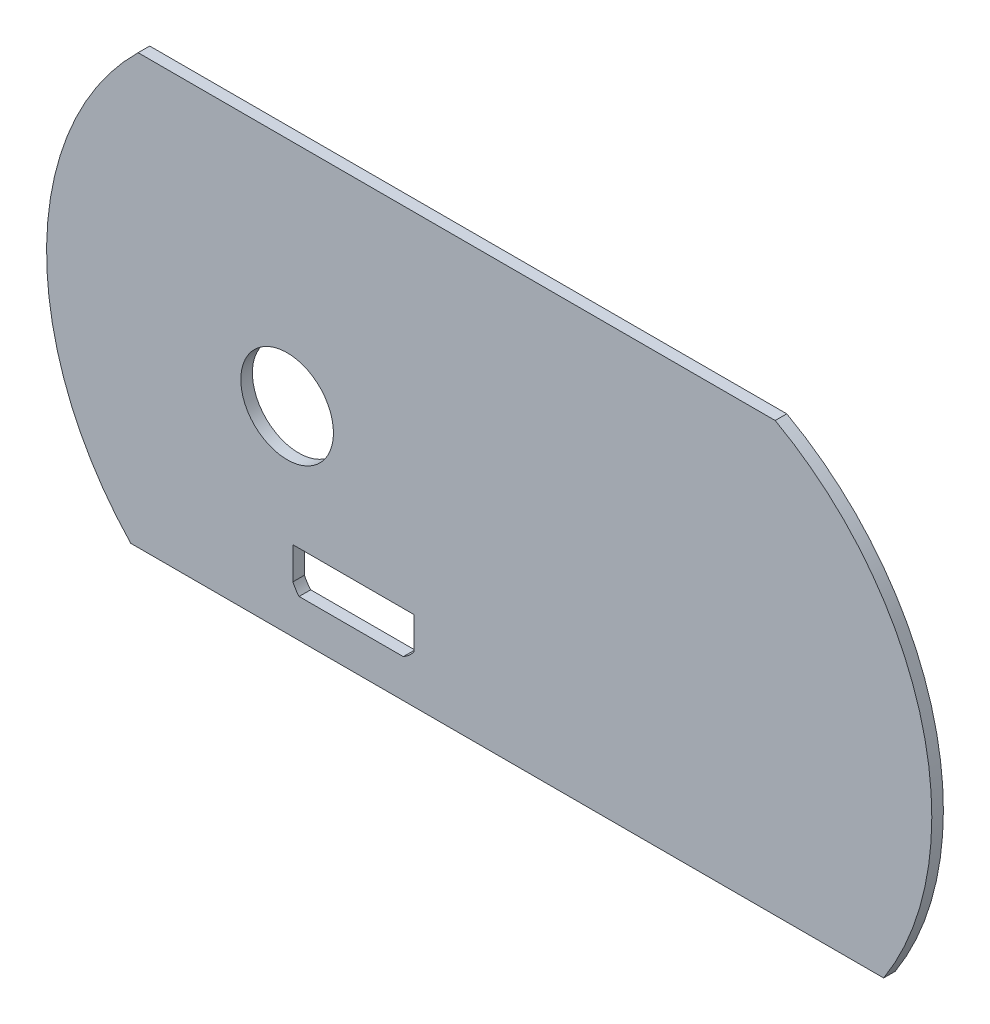
from build123d import *

# Parameters (mm, degrees)
SKETCH_1_R      = 4
EXTRUDE_1_DEPTH = 1


with BuildPart() as part:
    # 草图1 → 凸台-拉伸1 (new body)
    with BuildSketch(Plane.XY):
        with BuildLine():
            Line((-30.308871265, 18.5), (24.691128735, 18.5))
            ThreePointArc((24.691128735, 18.5), (37.414867681, 2.03528305), (34.05591144, -18.5))
            Line((34.05591144, -18.5), (-30.94408856, -18.5))
            ThreePointArc((-30.94408856, -18.5), (-38.208814547, 0.130173786), (-30.308871265, 18.5))
        make_face()
        with Locations((-17.44408856, -1.5)):
            Circle(SKETCH_1_R, mode=Mode.SUBTRACT)
        with BuildLine():
            Line((-16.94408856, -11.603927424), (-6.484848095, -11.603927424))
            Line((-6.484848095, -11.603927424), (-6.484848095, -14.383556294))
            ThreePointArc((-6.484848095, -14.383556294), (-6.906034088, -14.843943267), (-7.412736188, -15.208095416))
            Line((-7.412736188, -15.208095416), (-16.411800764, -15.208095416))
            ThreePointArc((-16.411800764, -15.208095416), (-16.710853614, -14.817070491), (-16.94408856, -14.383556294))
            Line((-16.94408856, -14.383556294), (-16.94408856, -11.603927424))
        make_face(mode=Mode.SUBTRACT)
    extrude(amount=EXTRUDE_1_DEPTH)


solid = part.part
